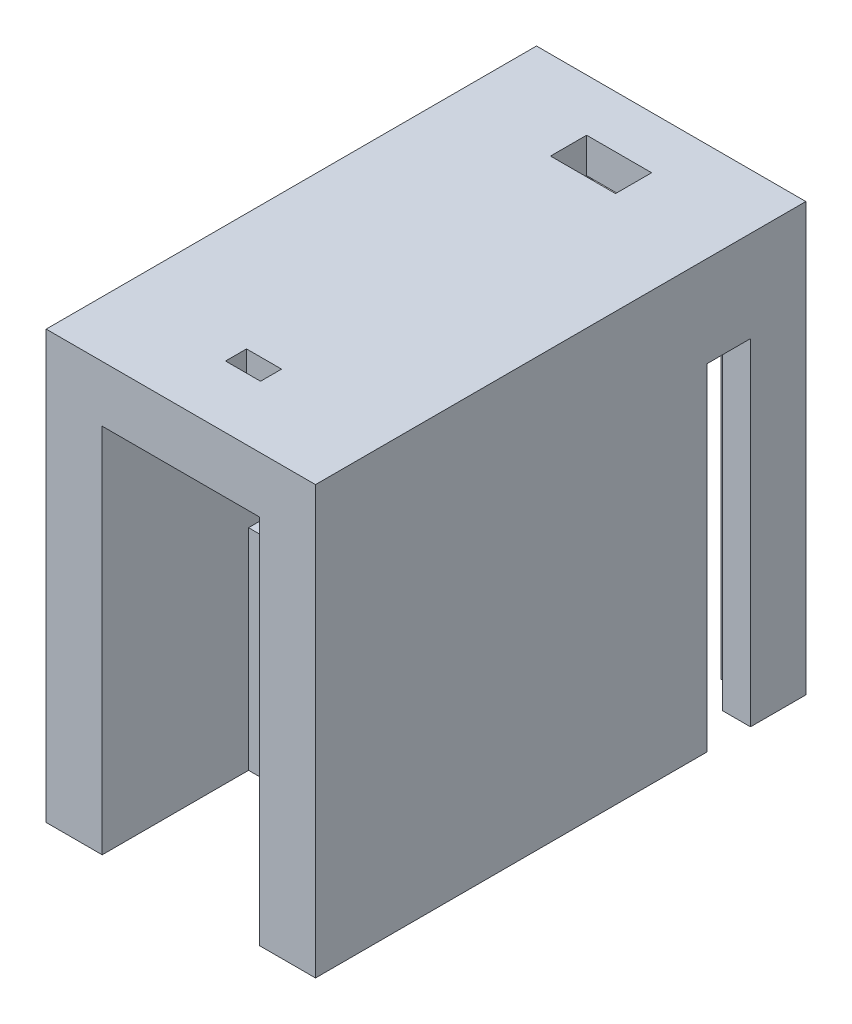
from build123d import *

# Parameters (mm, degrees)
BOSS_EXTRUDE1_DEPTH      = 20
BOSS_EXTRUDE1_DEPTH_BACK = 50
SKETCH4_W                = 5
SKETCH4_H                = 3
CUT_EXTRUDE1_DEPTH       = 25
CUT_EXTRUDE5_DEPTH       = 56
SKETCH10_W               = 35
SKETCH10_H               = 30
BOSS_EXTRUDE2_DEPTH      = 25
SKETCH13_W               = 9.28125
SKETCH13_H               = 5.15625
CUT_EXTRUDE6_DEPTH       = 25
SKETCH16_W               = 4
SKETCH16_H               = 8
BOSS_EXTRUDE4_DEPTH      = 6.2
SKETCH11_W               = 10
SKETCH11_H               = 10
CUT_EXTRUDE7_DEPTH       = 2


with BuildPart() as part:
    # Sketch1 → Boss-Extrude1 (new, two sides: drawn at the far end of the back side and taken through both)
    with BuildSketch(Plane.XY.offset(-BOSS_EXTRUDE1_DEPTH_BACK)):
        Polygon((-19.25, -26.5), (-11.25, -26.5), (-11.25, 26.5), (11.202, 26.5), (11.202, -26.5), (19.202, -26.5), (19.202, 34.5), (-19.25, 34.5), align=None)
    extrude(amount=BOSS_EXTRUDE1_DEPTH + BOSS_EXTRUDE1_DEPTH_BACK)

    # Sketch4 → Cut-Extrude1 (cut, symmetric)
    with BuildSketch(Plane(origin=(0, 31.309460855, 0), x_dir=(1, 0, 0), z_dir=(0, 1, 0))):
        with Locations((0, -9.645390894)):
            Rectangle(SKETCH4_W, SKETCH4_H)
    extrude(amount=CUT_EXTRUDE1_DEPTH, both=True, mode=Mode.SUBTRACT)

    # Sketch9 → Cut-Extrude5 (cut)
    with BuildSketch(Plane.XZ.offset(26.5)):
        Polygon((-15.25, -45.893834316), (15.202, -45.893834316), (15.202, -42.098185739), (21.427419281, -42.098185739), (21.427419281, -35.893834316), (15.202, -35.893834316), (-15.25, -35.893834316), (-21.646518422, -35.893834316), (-21.646518422, -42.093834316), (-15.25, -42.093834316), align=None)
    extrude(amount=-CUT_EXTRUDE5_DEPTH, mode=Mode.SUBTRACT)

    # Sketch10 → Boss-Extrude2 (add)
    with BuildSketch(Plane.ZY.offset(-11.202)):
        with Locations((-18.393834316, -11.5)):
            Rectangle(SKETCH10_W, SKETCH10_H)
    extrude(amount=BOSS_EXTRUDE2_DEPTH)

    # Sketch13 → Cut-Extrude6 (cut)
    with BuildSketch(Plane(origin=(0, 34.5, 0), x_dir=(1, 0, 0), z_dir=(0, 1, 0))):
        with Locations((-0.003125, 39.971959316)):
            Rectangle(SKETCH13_W, SKETCH13_H)
    extrude(amount=-CUT_EXTRUDE6_DEPTH, mode=Mode.SUBTRACT)

    # Sketch16 → Boss-Extrude4 (add)
    with BuildSketch(Plane.XY.offset(-42.093834316)):
        with Locations((-17.25, 25.5)):
            Rectangle(SKETCH16_W, SKETCH16_H)
        with Locations((17.202, 25.5)):
            Rectangle(SKETCH16_W, SKETCH16_H)
    extrude(amount=BOSS_EXTRUDE4_DEPTH)

    # Sketch11 → Cut-Extrude7 (cut)
    with BuildSketch(Plane.XY.offset(-0.893834316)):
        with Locations((-0.041292147, -15.960614003)):
            Rectangle(SKETCH11_W, SKETCH11_H)
    extrude(amount=-CUT_EXTRUDE7_DEPTH, mode=Mode.SUBTRACT)


solid = part.part
